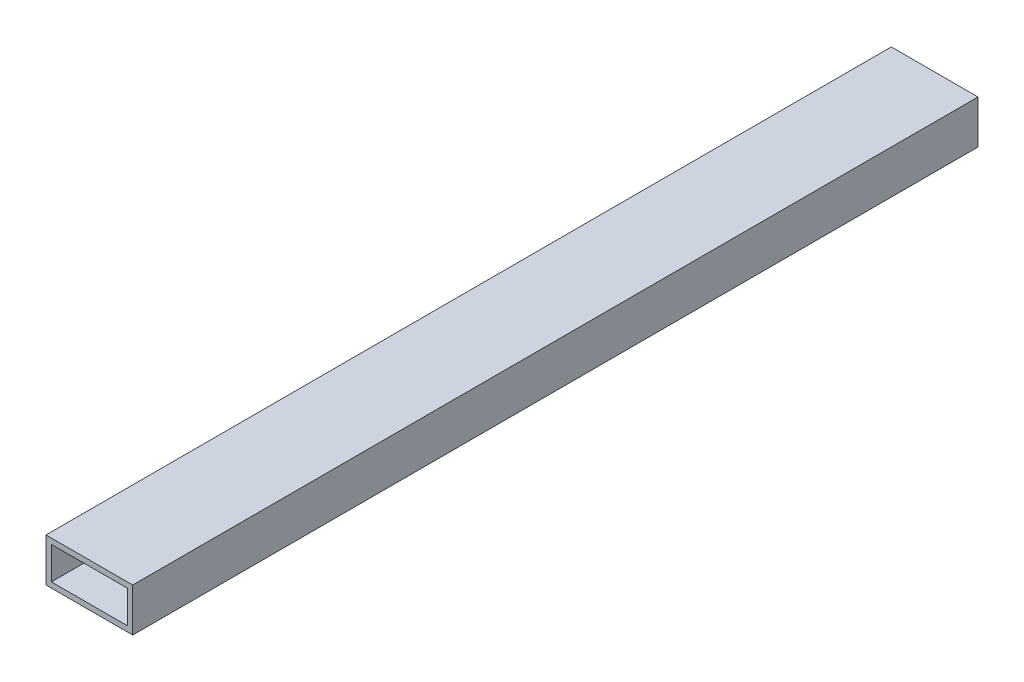
from build123d import *

# Parameters (mm, degrees)
SKETCH1_W           = 50.8
SKETCH1_H           = 25.4
SKETCH1_W_2         = 44.45
SKETCH1_H_2         = 19.05
BOSS_EXTRUDE1_DEPTH = 495.3


with BuildPart() as part:
    # Sketch1 → Boss-Extrude1 (new body)
    with BuildSketch(Plane.XY):
        with Locations((25.4, 12.7)):
            Rectangle(SKETCH1_W, SKETCH1_H)
        with Locations((25.4, 12.7)):
            Rectangle(SKETCH1_W_2, SKETCH1_H_2, mode=Mode.SUBTRACT)
    extrude(amount=BOSS_EXTRUDE1_DEPTH)


solid = part.part
